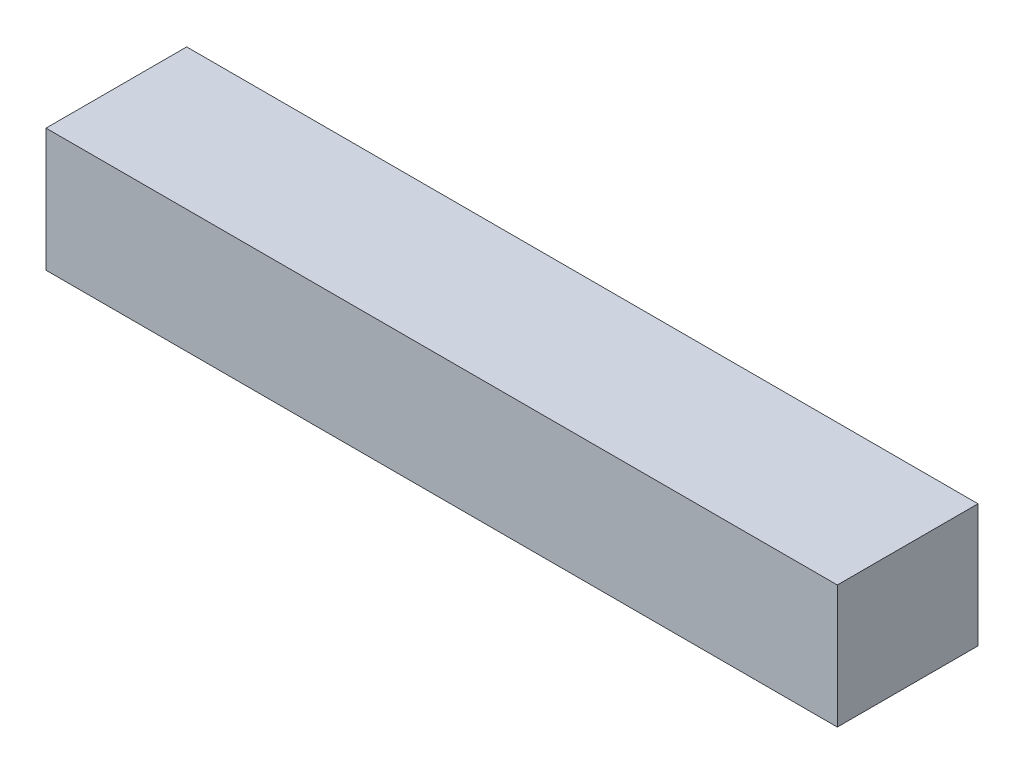
from build123d import *

# Parameters (mm, degrees)
SKETCH1_W           = 8
SKETCH1_H           = 7
BOSS_EXTRUDE1_DEPTH = 45


with BuildPart() as part:
    # Sketch1 → Boss-Extrude1 (new body)
    with BuildSketch(Plane(origin=(0, 0, 0), x_dir=(0, 0, -1), z_dir=(1, 0, 0))):
        with Locations((4, 3.5)):
            Rectangle(SKETCH1_W, SKETCH1_H)
    extrude(amount=BOSS_EXTRUDE1_DEPTH)


solid = part.part
